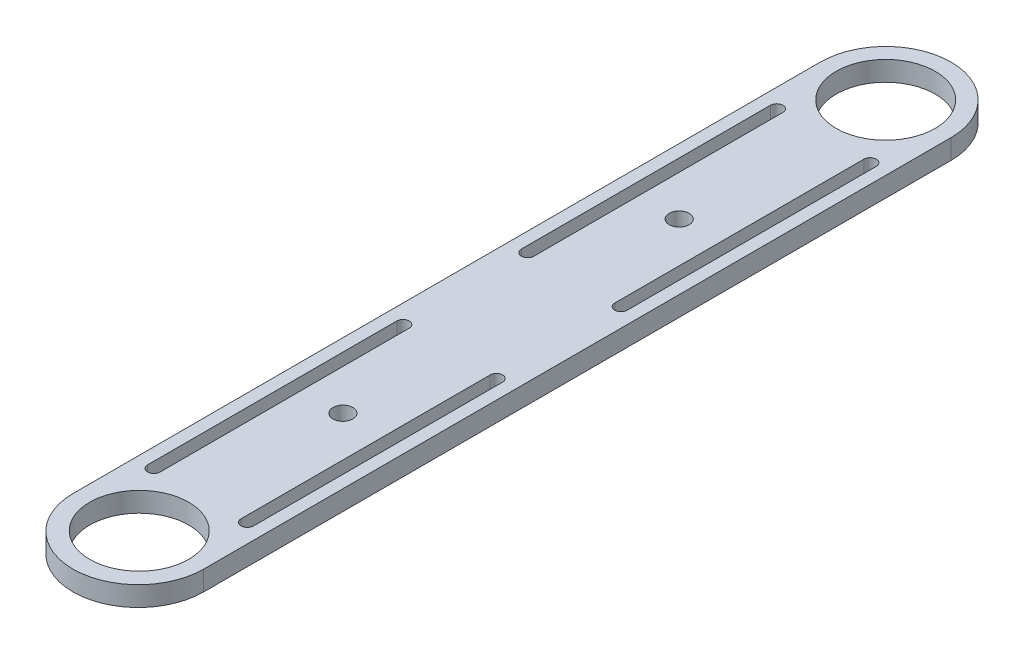
from build123d import *

# Parameters (mm, degrees)
BOSS_EXTRUDE1_DEPTH     = 3.175
CUT_EXTRUDE2_DEPTH      = 131.960225355
CUT_EXTRUDE2_DEPTH_BACK = 131.960225355
CUT_EXTRUDE3_DEPTH      = 131.960225355
CUT_EXTRUDE3_DEPTH_BACK = 131.960225355
SKETCH4_R               = 1.6
CUT_EXTRUDE4_DEPTH      = 131.960225355
CUT_EXTRUDE4_DEPTH_BACK = 131.960225355
SKETCH5_R               = 7.95


with BuildPart() as part:
    # Sketch1 → Boss-Extrude1 (new body)
    with BuildSketch(Plane(origin=(0, 0, 0), x_dir=(1, 0, 0), z_dir=(0, 1, 0))):
        with BuildLine():
            Line((-10.5, 0), (-10.5, -120))
            ThreePointArc((-10.5, -120), (0, -130.5), (10.5, -120))
            Line((10.5, -120), (10.5, 0))
            ThreePointArc((10.5, 0), (0, 10.5), (-10.5, 0))
        make_face()
    extrude(amount=BOSS_EXTRUDE1_DEPTH)

    # Sketch3 → Cut-Extrude2 (cut, two sides: drawn at the far end of the back side and taken through both)
    with BuildSketch(Plane.XZ.offset(-CUT_EXTRUDE2_DEPTH_BACK)):
        with BuildLine():
            Line((-8.5, 110), (-8.5, 70))
            ThreePointArc((-8.5, 70), (-7.5, 69), (-6.5, 70))
            Line((-6.5, 70), (-6.5, 110))
            ThreePointArc((-6.5, 110), (-7.5, 111), (-8.5, 110))
        make_face()
        with BuildLine():
            Line((6.5, 110), (6.5, 70))
            ThreePointArc((6.5, 70), (7.5, 69), (8.5, 70))
            Line((8.5, 70), (8.5, 110))
            ThreePointArc((8.5, 110), (7.5, 111), (6.5, 110))
        make_face()
        with BuildLine():
            Line((8.5, 10), (8.5, 50))
            ThreePointArc((8.5, 50), (7.5, 51), (6.5, 50))
            Line((6.5, 50), (6.5, 10))
            ThreePointArc((6.5, 10), (7.5, 9), (8.5, 10))
        make_face()
        with BuildLine():
            Line((-8.5, 50), (-8.5, 10))
            ThreePointArc((-8.5, 10), (-7.5, 9), (-6.5, 10))
            Line((-6.5, 10), (-6.5, 50))
            ThreePointArc((-6.5, 50), (-7.5, 51), (-8.5, 50))
        make_face()
    extrude(amount=CUT_EXTRUDE2_DEPTH + CUT_EXTRUDE2_DEPTH_BACK, mode=Mode.SUBTRACT)

    # Sketch4 → Cut-Extrude3 (cut, two sides: drawn at the far end of the back side and taken through both)
    with BuildSketch(Plane(origin=(0, 3.175, 0), x_dir=(1, 0, 0), z_dir=(0, 1, 0)).offset(-CUT_EXTRUDE3_DEPTH_BACK)):
        with Locations(Location((0, -33.15, 0), (0, 0, 270))):
            Circle(SKETCH4_R)
        with Locations(Location((0, -87.15, 0), (0, 0, 270))):
            Circle(SKETCH4_R)
    extrude(amount=CUT_EXTRUDE3_DEPTH + CUT_EXTRUDE3_DEPTH_BACK, mode=Mode.SUBTRACT)

    # Sketch5 → Cut-Extrude4 (cut, two sides: drawn at the far end of the back side and taken through both)
    with BuildSketch(Plane(origin=(0, 3.175, 0), x_dir=(1, 0, 0), z_dir=(0, 1, 0)).offset(-CUT_EXTRUDE4_DEPTH_BACK)):
        with Locations(Location((0, 0, 0), (0, 0, 270))):
            Circle(SKETCH5_R)
        with Locations(Location((-0.003223035, -119.850034657, 0), (0, 0, 270))):
            Circle(SKETCH5_R)
    extrude(amount=CUT_EXTRUDE4_DEPTH + CUT_EXTRUDE4_DEPTH_BACK, mode=Mode.SUBTRACT)


solid = part.part
